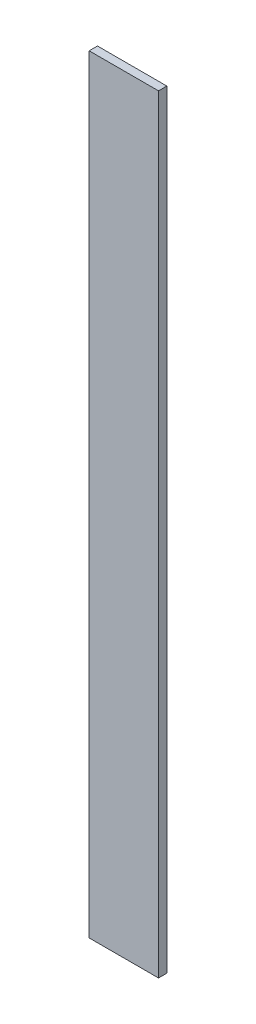
from build123d import *

# Parameters (mm, degrees)
SKETCH1_W           = 25
SKETCH1_H           = 277
BOSS_EXTRUDE1_DEPTH = 3


with BuildPart() as part:
    # Sketch1 → Boss-Extrude1 (new body)
    with BuildSketch(Plane.XY):
        Rectangle(SKETCH1_W, SKETCH1_H)
    extrude(amount=BOSS_EXTRUDE1_DEPTH)


solid = part.part
